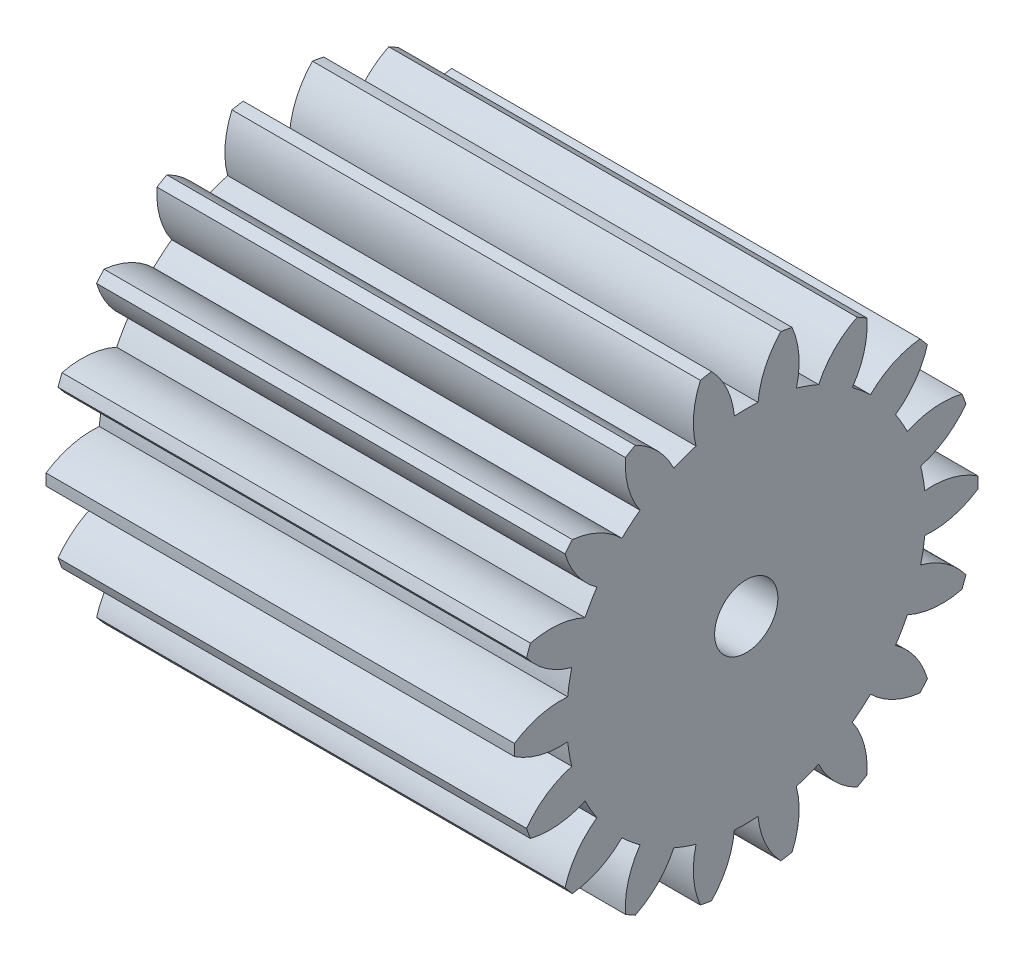
from build123d import *

# Parameters (mm, degrees)
BASPROSKE_W     = 22.23
BASPROSKE_H     = 11
TOOTHCUT_DEPTH  = 28.132506335
TEETHCUTS_COUNT = 18
TEETHCUTS_ANGLE = 340
BORSKE_R        = 1.5
BORE_DEPTH      = 50.0001524


with BuildPart() as part:
    # BasProSke → Base-Revolve (revolve)
    with BuildSketch(Plane(origin=(0, 0, 0), x_dir=(1, 0, 0), z_dir=(0, 1, 0)), mode=Mode.PRIVATE) as base_revolve_sk:
        with Locations((11.115, 5.5)):
            Rectangle(BASPROSKE_W, BASPROSKE_H)
    revolve(base_revolve_sk.sketch.rotate(Axis((-10, 0, 0), (1, 0, 0)), 180), axis=Axis((-10, 0, 0), (1, 0, 0)))

    # TooCutSke → ToothCut (cut, through all)
    with BuildSketch(Plane(origin=(0, 0, 0), x_dir=(0, 0, -1), z_dir=(1, 0, 0))):
        with BuildLine():
            ThreePointArc((0.562016592, 8.505451978), (0, 8.524), (-0.562016592, 8.505451978))
            ThreePointArc((-0.562016592, 8.505451978), (-0.908527098, 9.79664918), (-1.664940793, 10.898964048))
            ThreePointArc((-1.664940793, 10.898964048), (0, 11.0254), (1.664940793, 10.898964048))
            ThreePointArc((1.664940793, 10.898964048), (0.908527098, 9.79664918), (0.562016592, 8.505451978))
        make_face()
    toothcut = extrude(amount=TOOTHCUT_DEPTH, mode=Mode.SUBTRACT)

    # TeethCuts: ToothCut ×18 about axis
    teethcuts_axis = Axis((-10, 0, 0), (1, 0, 0))
    for i in range(1, TEETHCUTS_COUNT):
        add(toothcut.rotate(teethcuts_axis, i * TEETHCUTS_ANGLE / (TEETHCUTS_COUNT - 1)), mode=Mode.SUBTRACT)

    # BorSke → Bore (cut, symmetric)
    with BuildSketch(Plane(origin=(0, 0, 0), x_dir=(0, 0, -1), z_dir=(1, 0, 0))):
        with Locations(Location((0, 0, 0), (0, 0, 180))):
            Circle(BORSKE_R)
    extrude(amount=BORE_DEPTH, both=True, mode=Mode.SUBTRACT)


solid = part.part
